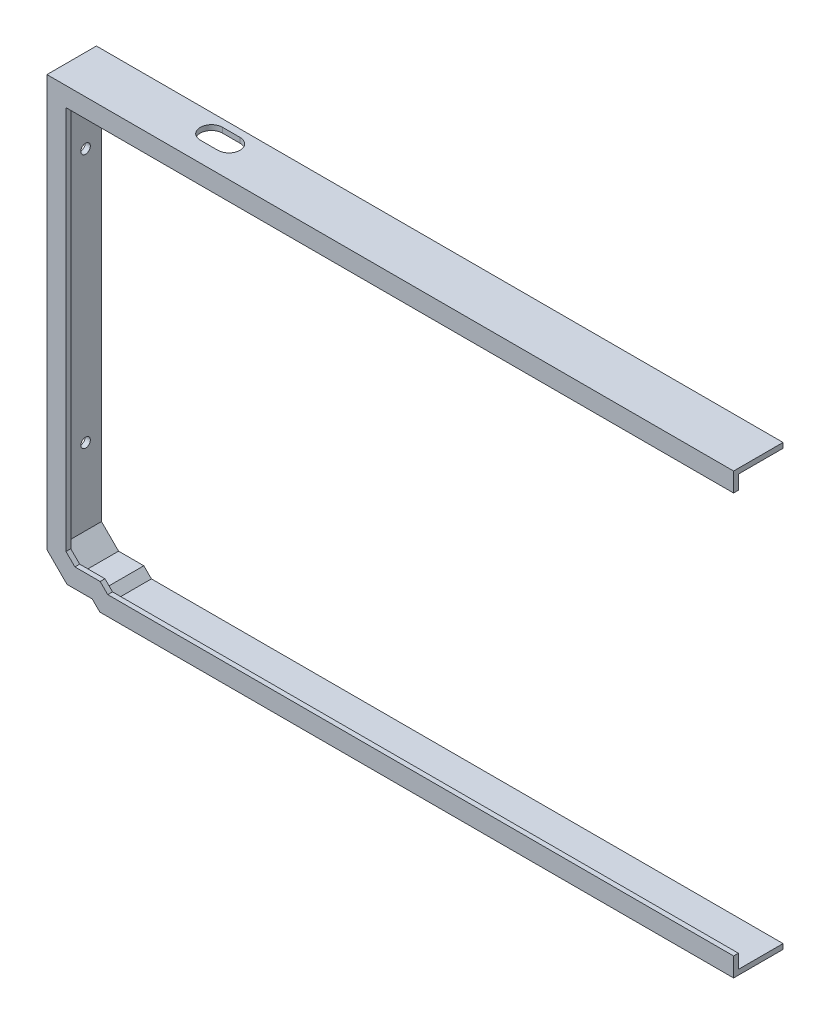
from build123d import *

# Parameters (mm, degrees)
P_IDAT_VYSUNUT_M1_DEPTH  = 14.05
P_IDAT_VYSUNUT_M2_DEPTH  = 1.5
ODEBRAT_VYSUNUT_M1_DEPTH = 1.6
ODEBRAT_VYSUNUT_M2_REACH = 454.909
SKICA4_R                 = 1.5
SKICA5_W                 = 215.84
SKICA5_H                 = 15.55
ODEBRAT_VYSUNUT_M3_DEPTH = 452.805134863


with BuildPart() as part:
    # Skica1 → Přidat vysunutím1 (new body)
    with BuildSketch(Plane.XY):
        Polygon((-1.7, 1.7), (429.98, 1.7), (429.98, -127.624163056), (423.673791129, -133.930371927), (415.733791129, -133.930371927), (413.350841277, -136.313321779), (14.929158723, -136.313321779), (12.546208871, -133.930371927), (4.606208871, -133.930371927), (-1.7, -127.624163056), align=None)
        Polygon((-0.1, 0.1), (428.38, 0.1), (428.38, -126.961421356), (423.01104943, -132.330371927), (415.07104943, -132.330371927), (412.688099577, -134.713321779), (15.591900423, -134.713321779), (13.20895057, -132.330371927), (5.26895057, -132.330371927), (-0.1, -126.961421356), align=None, mode=Mode.SUBTRACT)
    extrude(amount=-P_IDAT_VYSUNUT_M1_DEPTH)

    # Skica2 → Přidat vysunutím2 (add)
    with BuildSketch(Plane.XY):
        Polygon((-1.7, 1.7), (-1.7, -127.624163056), (4.606208871, -133.930371927), (12.546208871, -133.930371927), (14.929158723, -136.313321779), (413.350841277, -136.313321779), (415.733791129, -133.930371927), (423.673791129, -133.930371927), (429.98, -127.624163056), (429.98, 1.7), align=None)
        Polygon((4.3, -4.3), (4.3, -125.138881682), (7.091490245, -127.930371927), (15.031490245, -127.930371927), (17.414440098, -130.313321779), (410.865559902, -130.313321779), (413.248509755, -127.930371927), (421.188509755, -127.930371927), (423.98, -125.138881682), (423.98, -4.3), align=None, mode=Mode.SUBTRACT)
    extrude(amount=P_IDAT_VYSUNUT_M2_DEPTH)

    # Skica3 → Odebrat vysunutím1 (cut)
    with BuildSketch(Plane(origin=(0, 1.7, 0), x_dir=(1, 0, 0), z_dir=(0, 1, 0))):
        with BuildLine():
            Line((45.76, 4.75), (40.26, 4.75))
            ThreePointArc((40.26, 4.75), (36.76, 8.25), (40.26, 11.75))
            Line((40.26, 11.75), (45.76, 11.75))
            ThreePointArc((45.76, 11.75), (49.26, 8.25), (45.76, 4.75))
        make_face()
    extrude(amount=-ODEBRAT_VYSUNUT_M1_DEPTH, mode=Mode.SUBTRACT)

    # Odebrat vysunutím2: up to this face of the body (flat: up to its plane)
    odebrat_vysunut_m2_end = Plane(part.part.faces().sort_by_distance((429.98, -62.962081528, -6.275))[0])
    # Skica4 → Odebrat vysunutím2 (cut, up to the picked face)
    with BuildSketch(Plane.ZY.offset(1.7), mode=Mode.PRIVATE) as odebrat_vysunut_m2_sk1:
        with Locations(Location((-9.05, -22.962081528, 0), (0, 0, 180))):
            Circle(SKICA4_R)
    odebrat_vysunut_m2_tool1 = split(extrude(odebrat_vysunut_m2_sk1.sketch, amount=-ODEBRAT_VYSUNUT_M2_REACH, mode=Mode.PRIVATE), bisect_by=odebrat_vysunut_m2_end, keep=Keep.BOTH, mode=Mode.PRIVATE)
    # Skica4 → Odebrat vysunutím2 (cut, up to the picked face)
    with BuildSketch(Plane.ZY.offset(1.7), mode=Mode.PRIVATE) as odebrat_vysunut_m2_sk2:
        with Locations(Location((-9.05, -102.962081528, 0), (0, 0, 180))):
            Circle(SKICA4_R)
    odebrat_vysunut_m2_tool2 = split(extrude(odebrat_vysunut_m2_sk2.sketch, amount=-ODEBRAT_VYSUNUT_M2_REACH, mode=Mode.PRIVATE), bisect_by=odebrat_vysunut_m2_end, keep=Keep.BOTH, mode=Mode.PRIVATE)
    add(odebrat_vysunut_m2_tool1.solids().sort_by(Axis((-1.7, -22.962082, -9.05), (1, 0, 0)))[0], mode=Mode.SUBTRACT)
    add(odebrat_vysunut_m2_tool2.solids().sort_by(Axis((-1.7, -102.962082, -9.05), (1, 0, 0)))[0], mode=Mode.SUBTRACT)

    # Skica5 → Odebrat vysunutím3 (cut, through all)
    with BuildSketch(Plane(origin=(0, 1.7, 0), x_dir=(1, 0, 0), z_dir=(0, 1, 0))):
        with Locations((322.06, 6.275)):
            Rectangle(SKICA5_W, SKICA5_H)
    extrude(amount=-ODEBRAT_VYSUNUT_M3_DEPTH, mode=Mode.SUBTRACT)


solid = part.part
